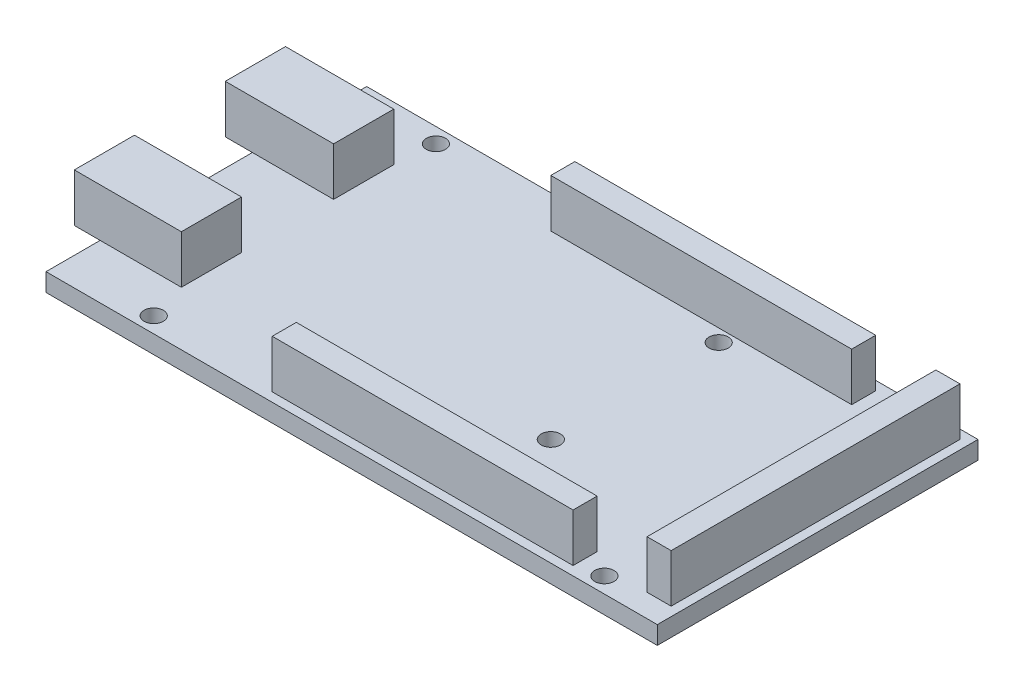
from build123d import *

# Parameters (mm, degrees)
SKETCH1_W            = 101.6
SKETCH1_H            = 53.3
BOSS_EXTRUDE1_DEPTH  = 3
SKETCH2_W            = 50
SKETCH2_H            = 4
SKETCH2_W_2          = 4
SKETCH2_H_2          = 48
SKETCH2_W_3          = 18
SKETCH2_H_3          = 10
SKETCH2_W_4          = 17.796210121
BOSS_EXTRUDE2_DEPTH  = 8
M3_CLEARANCE_HOLE1_D = 3.2


with BuildPart() as part:
    # Sketch1 → Boss-Extrude1 (new body)
    with BuildSketch(Plane(origin=(0, 0, 0), x_dir=(1, 0, 0), z_dir=(0, 1, 0))):
        with Locations((50.8, 26.65)):
            Rectangle(SKETCH1_W, SKETCH1_H)
    extrude(amount=BOSS_EXTRUDE1_DEPTH)

    # Sketch2 → Boss-Extrude2 (add)
    with BuildSketch(Plane(origin=(0, 3, 0), x_dir=(1, 0, 0), z_dir=(0, 1, 0))):
        with Locations((61.1, 49.8)):
            Rectangle(SKETCH2_W, SKETCH2_H)
        with Locations((98.1, 27.8)):
            Rectangle(SKETCH2_W_2, SKETCH2_H_2)
        with Locations((61.1, 3.5)):
            Rectangle(SKETCH2_W, SKETCH2_H)
        with Locations((4.5, 39.3)):
            Rectangle(SKETCH2_W_3, SKETCH2_H_3)
        with Locations((4.601894939, 14)):
            Rectangle(SKETCH2_W_4, SKETCH2_H_3)
    extrude(amount=BOSS_EXTRUDE2_DEPTH)

    # M3 Clearance Hole1 (through all)
    with Locations(Plane(origin=(0, 0, 0), x_dir=(-1, 0, 0), z_dir=(0, -1, 0))):
        with Locations((-14, 50.8), (-66.1, 45.7), (-66.1, 17.8), (-92.7, 50.8), (-15.3, 2.6), (-90.2, 2.6)):
            Hole(M3_CLEARANCE_HOLE1_D / 2)


solid = part.part
